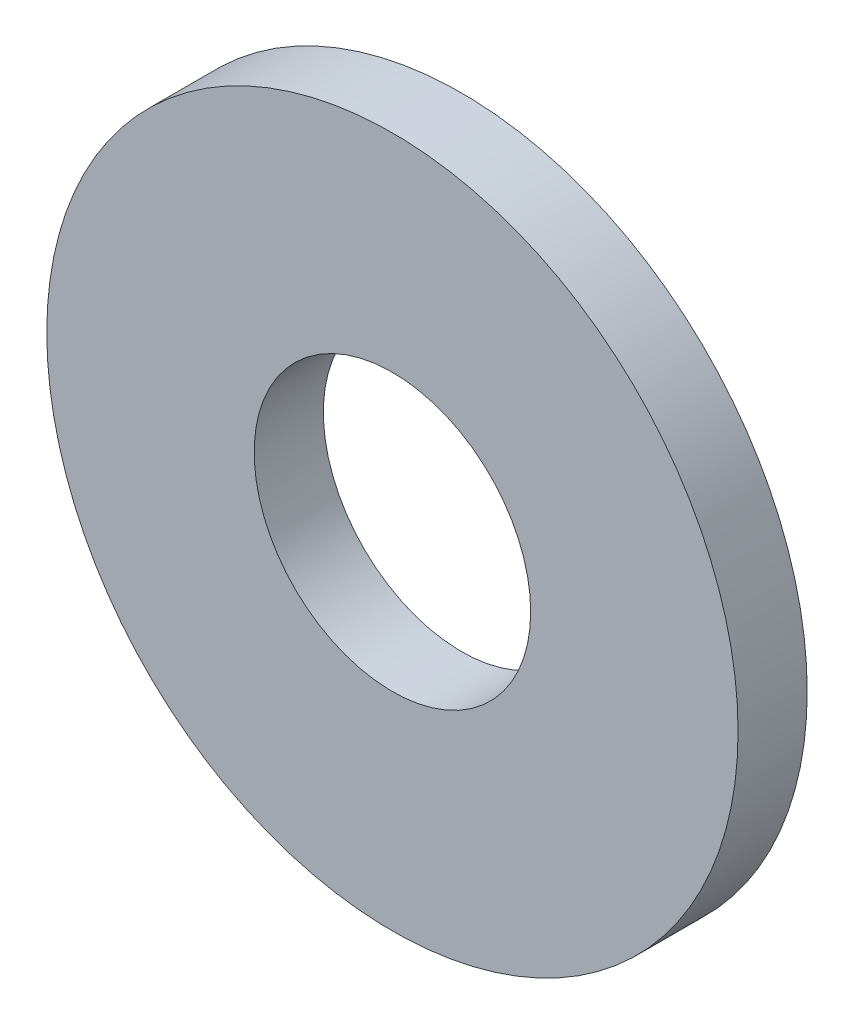
from build123d import *

# Parameters (mm, degrees)
SCHIZZO1_R                   = 25
SCHIZZO1_R_2                 = 10
ESTRUSIONE_ESTRUSIONE1_DEPTH = 5


with BuildPart() as part:
    # Schizzo1 → Estrusione-Estrusione1 (new body)
    with BuildSketch(Plane.XY):
        Circle(SCHIZZO1_R)
        Circle(SCHIZZO1_R_2, mode=Mode.SUBTRACT)
    extrude(amount=ESTRUSIONE_ESTRUSIONE1_DEPTH)


solid = part.part
